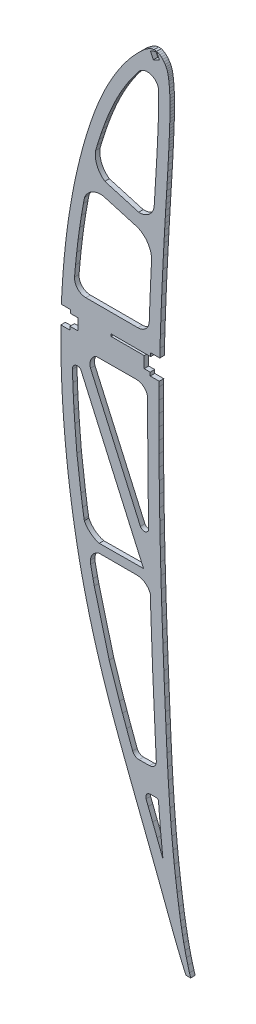
from build123d import *

# Parameters (mm, degrees)
EXTRUDE_1_DEPTH = 2


with BuildPart() as part:
    # Model → 凸台-拉伸1 (new body)
    with BuildSketch(Plane.XY):
        Polygon((43.850174871, 236.886299562), (43.850174871, 237.886299562), (61.338896891, 237.886299562), (61.338896891, 239.385577042), (65.379338159, 239.385577042), (65.486084254, 243.230870612), (65.650078365, 248.369915166), (65.831750008, 253.516738207), (66.029537281, 258.661262013), (66.243396564, 263.804485633), (66.47228519, 268.947364496), (66.717245826, 274.088943173), (66.976193138, 279.231132521), (67.249127124, 284.37393254), (67.390958025, 286.948569601), (67.535829689, 289.522338472), (67.683742117, 292.095239153), (67.833696262, 294.667228024), (67.986603931, 297.240346802), (68.141509697, 299.813552818), (68.297414511, 302.386802454), (68.455317422, 304.960139329), (68.612264904, 307.532433536), (68.76717067, 310.105639553), (68.91912291, 312.677715663), (69.065037242, 315.250529105), (69.204913665, 317.824079879), (69.335711416, 320.399236175), (69.396680003, 321.685119463), (69.456649542, 322.970959132), (69.513621937, 324.256667943), (69.568596235, 325.542289515), (69.621572436, 326.827823848), (69.672550541, 328.113270943), (69.721486931, 329.399629847), (69.768512462, 330.683903416), (69.812584469, 331.967047078), (69.851617614, 333.250971692), (69.882658375, 334.53454735), (69.90561951, 335.81977215), (69.916592067, 337.104473517), (69.914446139, 338.391604977), (69.897401726, 339.67608405), (69.864328922, 340.96086426), (69.814272299, 342.244902942), (69.745277379, 343.527113806), (69.656388733, 344.806454186), (69.546650932, 346.081881415), (69.414065881, 347.353308253), (69.328973034, 348.064273236), (69.226939987, 348.773497641), (69.101104261, 349.477678989), (68.942430801, 350.177423752), (68.741928174, 350.872339356), (68.492690281, 351.560122368), (68.183727592, 352.240292977), (67.760468238, 352.993547595), (67.2625898, 353.713515692), (66.70091153, 354.381651548), (66.085428108, 354.975369626), (65.428088689, 355.473170679), (64.738713477, 355.856465367), (64.026341723, 356.101625485), (62.864772411, 356.181034123), (61.688018623, 355.920456832), (60.511402447, 355.381620702), (59.348160633, 354.628163683), (58.214570693, 353.722855531), (57.12382576, 352.730333244), (56.09024887, 351.712280293), (55.348565983, 350.955207975), (54.644192637, 350.214778916), (53.970397212, 349.484693493), (53.323314373, 348.761780083), (52.696299736, 348.037740964), (52.085487969, 347.309404514), (51.485146496, 346.570514727), (50.521108765, 345.33528833), (49.572715245, 344.062708772), (48.641745937, 342.757858533), (47.730024458, 341.424821044), (46.840329858, 340.068722405), (45.973399468, 338.695600525), (45.131056906, 337.309538835), (44.374615701, 336.019315326), (43.641501559, 334.722102677), (42.929716386, 333.41781365), (42.238304751, 332.105405576), (41.567310275, 330.783879408), (40.91569029, 329.454190575), (40.282532985, 328.114297359), (39.696060836, 326.828492002), (39.125966032, 325.53439312), (38.570206859, 324.232912524), (38.028739696, 322.925049263), (37.501564545, 321.610803335), (36.987682356, 320.290131121), (36.486006842, 318.964987099), (35.553052213, 316.398849795), (34.661712852, 313.819515164), (33.811945139, 311.227982251), (33.000751931, 308.624120201), (32.225092462, 306.008797202), (31.483924065, 303.382968684), (30.775161405, 300.748545504), (30.112778564, 298.175203519), (29.479717077, 295.59513411), (28.873935227, 293.009249087), (28.296432064, 290.41759207), (27.745253109, 287.819076771), (27.221353792, 285.214745857), (26.723735064, 282.604555711), (25.825344876, 277.48149246), (25.023692086, 272.343634754), (24.315735929, 267.191850784), (23.697392974, 262.027964167), (23.164623409, 256.852799475), (22.714299231, 251.669222994), (22.342337007, 246.479058343), (22.048985863, 241.345376418), (21.91414288, 238.214788101), (25.849593636, 238.214788101), (25.849593636, 236.716177613), (28.169139089, 236.716177613), (29.169139089, 236.716177613), (29.259093636, 236.716177613), (29.259093636, 231.716177613), (25.676350645, 231.716177613), (25.676350645, 230.216198606), (21.668414736, 230.216198606), (21.645766461, 225.9354112), (21.686699817, 220.797105792), (21.793752909, 215.65837544), (21.966817578, 210.521217216), (22.202465585, 205.393457177), (22.50196586, 200.270156719), (22.864265788, 195.152260299), (23.28842091, 190.038715302), (23.773378612, 184.930466187), (24.319138893, 179.827512952), (24.924757295, 174.728802983), (25.594743635, 169.606539489), (26.326314776, 164.493620101), (27.122358171, 159.392204129), (27.98492497, 154.301401195), (28.914905554, 149.22326245), (29.916348147, 144.157005673), (30.991141666, 139.104736094), (32.158752702, 133.984386354), (33.403438416, 128.88323281), (34.721150583, 123.802057686), (36.113940354, 118.739970601), (37.578703963, 113.698806393), (39.114442871, 108.678510983), (40.721157081, 103.679084371), (42.431701671, 98.593146188), (44.205125111, 93.529641245), (46.030551655, 88.485977603), (47.898212251, 83.457620327), (49.799282306, 78.441087097), (51.723992767, 73.431842979), (53.662466427, 68.42735011), (55.616271571, 63.398650928), (57.569914478, 58.372947357), (59.522558849, 53.347189706), (61.470264615, 48.320163125), (63.410144324, 43.289708303), (65.339310524, 38.253665931), (67.256818756, 33.210983393), (68.210769465, 30.685876852), (69.164612016, 28.162767384), (70.122394635, 25.640872768), (71.088003311, 23.122406392), (72.06632257, 20.609635724), (73.062345094, 18.102831159), (74.078958337, 15.604152005), (75.136245033, 13.075628751), (76.215066904, 10.556283525), (76.939164139, 8.937793403), (79.043523482, 8.937793403), (78.499935121, 10.676021702), (77.797507495, 13.216753178), (77.140471769, 15.769957645), (76.546509931, 18.286519454), (75.999046687, 20.81361126), (75.493143431, 23.349964133), (75.024806017, 25.895361757), (74.586208387, 28.446375893), (74.175299391, 31.003896918), (73.78425297, 33.564496593), (73.05786571, 38.65566449), (72.39133657, 43.751075651), (71.781615864, 48.851566379), (71.227705053, 53.957082593), (70.723612918, 59.067299821), (70.268286844, 64.183162521), (69.85873122, 69.304508457), (69.490494151, 74.421081867), (69.160255555, 79.538711735), (68.861025674, 84.65701951), (68.586705131, 89.777677792), (68.333353858, 94.899471729), (68.092929483, 100.022967227), (67.860385244, 105.148892429), (67.632833688, 110.275088025), (67.409384436, 115.399502863), (67.190981947, 120.523189559), (66.978624756, 125.64620219), (66.773257322, 130.769593374), (66.576822639, 135.894469803), (66.390265166, 141.021884094), (66.214637517, 146.150891788), (66.049103392, 151.278443197), (65.895605786, 156.405645015), (65.754144699, 161.532497243), (65.624611973, 166.660996952), (65.506063151, 171.790091529), (65.400441227, 176.920887667), (65.306639506, 182.055328361), (65.225926919, 187.188475006), (65.159302004, 192.320381681), (65.106656601, 197.453045459), (65.069043328, 202.585521883), (65.047406642, 207.718863568), (65.040693926, 212.854014972), (65.05068594, 217.995078398), (65.077761235, 223.135064092), (65.120921275, 228.273917973), (65.146101689, 230.386406112), (61.163980104, 230.386406112), (61.163980104, 231.886299562), (58.504074871, 231.886299562), (58.504074871, 236.886299562), align=None)
        Polygon((64.008095768, 356.074274652), (61.282160574, 354.821178359), (62.5342142, 352.096198594), (65.260193013, 353.348295839), align=None, mode=Mode.SUBTRACT)
        with BuildLine():
            Line((30.374274121, 274.202817512), (30.758319621, 276.664196246))
            Line((30.758319621, 276.664196246), (31.642198975, 281.704511574))
            Line((31.642198975, 281.704511574), (32.128151273, 284.253507082))
            ThreePointArc((32.128151273, 284.253507082), (35.397512022, 287.984979182), (40.263467028, 288.951977432))
            Line((40.263467028, 288.951977432), (55.592885304, 284.522587206))
            ThreePointArc((55.592885304, 284.522587206), (60.324998263, 280.431061259), (61.723232999, 274.333650559))
            Line((61.723232999, 274.333650559), (61.477577761, 269.177492609))
            Line((61.477577761, 269.177492609), (61.248016622, 264.019503112))
            Line((61.248016622, 264.019503112), (61.033529041, 258.861169207))
            Line((61.033529041, 258.861169207), (60.729975381, 250.965620584))
            ThreePointArc((60.729975381, 250.965620584), (59.200621647, 247.554901981), (55.733666561, 246.157709557))
            Line((55.733666561, 246.157709557), (32.707526961, 246.157709557))
            ThreePointArc((32.707526961, 246.157709557), (29.022168778, 247.778636451), (27.726289071, 251.590455533))
            Line((27.726289071, 251.590455533), (28.142414759, 256.380381183))
            Line((28.142414759, 256.380381183), (28.666858866, 261.474674857))
            Line((28.666858866, 261.474674857), (29.27510201, 266.554216243))
            Line((29.27510201, 266.554216243), (29.97093989, 271.617815733))
            Line((29.97093989, 271.617815733), (30.374274121, 274.202817512))
        make_face(mode=Mode.SUBTRACT)
        with BuildLine():
            Line((37.028102844, 304.618767439), (37.784639216, 307.169612305))
            Line((37.784639216, 307.169612305), (38.574613525, 309.705363467))
            Line((38.574613525, 309.705363467), (39.400453673, 312.22392459))
            Line((39.400453673, 312.22392459), (40.265783225, 314.727992715))
            Line((40.265783225, 314.727992715), (41.173807483, 317.225557814))
            Line((41.173807483, 317.225557814), (41.65567902, 318.498390889))
            Line((41.65567902, 318.498390889), (42.151822083, 319.773473723))
            Line((42.151822083, 319.773473723), (42.659038474, 321.037962526))
            Line((42.659038474, 321.037962526), (43.179365069, 322.294762725))
            Line((43.179365069, 322.294762725), (43.713102697, 323.544673117))
            Line((43.713102697, 323.544673117), (44.258660953, 324.783074736))
            Line((44.258660953, 324.783074736), (44.817652962, 326.00863152))
            Line((44.817652962, 326.00863152), (45.421186874, 327.285835443))
            Line((45.421186874, 327.285835443), (46.041584161, 328.55181157))
            Line((46.041584161, 328.55181157), (46.679508163, 329.808205313))
            Line((46.679508163, 329.808205313), (47.336271292, 331.054845072))
            Line((47.336271292, 331.054845072), (48.012704116, 332.294353764))
            Line((48.012704116, 332.294353764), (48.708032371, 333.524705979))
            Line((48.708032371, 333.524705979), (49.424412669, 334.746599624))
            Line((49.424412669, 334.746599624), (50.224061361, 336.06240921))
            Line((50.224061361, 336.06240921), (51.044877686, 337.36249151))
            Line((51.044877686, 337.36249151), (51.884227414, 338.641853016))
            Line((51.884227414, 338.641853016), (52.740794994, 339.894249415))
            Line((52.740794994, 339.894249415), (53.612828588, 341.116495124))
            Line((53.612828588, 341.116495124), (54.496980837, 342.302874043))
            Line((54.496980837, 342.302874043), (55.396637073, 343.455608106))
            Line((55.396637073, 343.455608106), (55.546141861, 343.639615984))
            ThreePointArc((55.546141861, 343.639615984), (61.464890176, 345.950534188), (64.872282432, 340.587549704))
            Line((64.872282432, 340.587549704), (64.898255433, 339.578575725))
            Line((64.898255433, 339.578575725), (64.914501444, 338.354264818))
            Line((64.914501444, 338.354264818), (64.916556468, 337.121657497))
            Line((64.916556468, 337.121657497), (64.906000928, 335.885781685))
            Line((64.906000928, 335.885781685), (64.883738117, 334.639644855))
            Line((64.883738117, 334.639644855), (64.853454581, 333.387381414))
            Line((64.853454581, 333.387381414), (64.815192903, 332.12883283))
            Line((64.815192903, 332.12883283), (64.771653649, 330.861200092))
            Line((64.771653649, 330.861200092), (64.724965753, 329.586147407))
            Line((64.724965753, 329.586147407), (64.676317995, 328.307375554))
            Line((64.676317995, 328.307375554), (64.625653134, 327.029827127))
            Line((64.625653134, 327.029827127), (64.572995802, 325.75203055))
            Line((64.572995802, 325.75203055), (64.518352267, 324.474144175))
            Line((64.518352267, 324.474144175), (64.461808152, 323.198100431))
            Line((64.461808152, 323.198100431), (64.402109005, 321.918058396))
            Line((64.402109005, 321.918058396), (64.341721167, 320.64445523))
            Line((64.341721167, 320.64445523), (64.211800966, 318.086576198))
            Line((64.211800966, 318.086576198), (64.072725682, 315.527765382))
            Line((64.072725682, 315.527765382), (63.927478223, 312.966710472))
            Line((63.927478223, 312.966710472), (63.776038138, 310.403303568))
            Line((63.776038138, 310.403303568), (63.621300308, 307.832887207))
            Line((63.621300308, 307.832887207), (63.464598467, 305.26464601))
            Line((63.464598467, 305.26464601), (63.30680099, 302.69303224))
            Line((63.30680099, 302.69303224), (63.150661393, 300.115932062))
            Line((63.150661393, 300.115932062), (62.995639336, 297.540800473))
            Line((62.995639336, 297.540800473), (62.903634054, 296.012465006))
            ThreePointArc((62.903634054, 296.012465006), (60.544141572, 291.977384464), (56.089859449, 290.560186342))
            Line((56.089859449, 290.560186342), (41.102686095, 294.875237289))
            ThreePointArc((41.102686095, 294.875237289), (37.667869738, 299.162580622), (37.028102844, 304.618767439))
        make_face(mode=Mode.SUBTRACT)
        with BuildLine():
            Line((60.066594585, 221.028351207), (60.050711535, 218.013106135))
            Line((60.050711535, 218.013106135), (60.040687575, 212.855605871))
            Line((60.040687575, 212.855605871), (60.113866489, 196.724475795))
            Line((60.113866489, 196.724475795), (60.159634871, 192.262287098))
            Line((60.159634871, 192.262287098), (60.226437175, 187.116716737))
            Line((60.226437175, 187.116716737), (60.3073575, 181.97035839))
            Line((60.3073575, 181.97035839), (60.401381175, 176.823768569))
            Line((60.401381175, 176.823768569), (60.507252229, 171.680870469))
            ThreePointArc((60.507252229, 171.680870469), (59.057184214, 169.707142027), (56.807151625, 170.674434413))
            Line((56.807151625, 170.674434413), (34.75557672, 220.203082572))
            ThreePointArc((34.75557672, 220.203082572), (34.936176082, 223.561892523), (37.292812298, 225.961993804))
            Line((37.292812298, 225.961993804), (55.046849762, 226.05464949))
            ThreePointArc((55.046849762, 226.05464949), (58.604503484, 224.587915526), (60.066594585, 221.028351207))
        make_face(mode=Mode.SUBTRACT)
        with BuildLine():
            Line((31.909861435, 161.141744721), (31.271416711, 165.233195185))
            Line((31.271416711, 165.233195185), (30.548604273, 170.284900367))
            Line((30.548604273, 170.284900367), (28.751389661, 184.664252492))
            Line((28.751389661, 184.664252492), (27.849650881, 195.535468195))
            Line((27.849650881, 195.535468195), (27.491652448, 200.592601143))
            Line((27.491652448, 200.592601143), (27.305296676, 203.780433316))
            Line((27.305296676, 203.780433316), (27.19576315, 205.654131638))
            Line((27.19576315, 205.654131638), (26.962951761, 210.720166161))
            Line((26.962951761, 210.720166161), (26.791999342, 215.794625487))
            ThreePointArc((26.791999342, 215.794625487), (27.933018653, 217.949328047), (30.364761636, 217.772426229))
            Line((30.364761636, 217.772426229), (58.200167956, 155.253080019))
            Line((58.200167956, 155.253080019), (38.632644302, 155.101417879))
            ThreePointArc((38.632644302, 155.101417879), (34.759910816, 157.083057348), (32.037200272, 160.475962731))
            Line((32.037200272, 160.475962731), (31.909861435, 161.141744721))
        make_face(mode=Mode.SUBTRACT)
        with BuildLine():
            Line((64.834780159, 69.45761191), (64.872486697, 68.933687829))
            Line((64.872486697, 68.933687829), (64.873691866, 68.917823804))
            Line((64.873691866, 68.917823804), (65.285986013, 63.762233627))
            Line((65.285986013, 63.762233627), (65.745417915, 58.600239479))
            Line((65.745417915, 58.600239479), (66.254246921, 53.442002372))
            Line((66.254246921, 53.442002372), (66.802401919, 48.389538733))
            Line((66.802401919, 48.389538733), (66.133985339, 50.1228624))
            Line((66.133985339, 50.1228624), (64.184849609, 55.153579716))
            Line((64.184849609, 55.153579716), (62.230506775, 60.183714995))
            Line((62.230506775, 60.183714995), (60.276544652, 65.210239957))
            Line((60.276544652, 65.210239957), (59.334904202, 67.63383208))
            ThreePointArc((59.334904202, 67.63383208), (59.542698446, 69.478950415), (61.178195322, 70.358035216))
            Line((61.178195322, 70.358035216), (63.82688816, 70.385773276))
            ThreePointArc((63.82688816, 70.385773276), (64.514772434, 70.121431477), (64.834780159, 69.45761191))
        make_face(mode=Mode.SUBTRACT)
        with BuildLine():
            Line((43.040406181, 112.591472421), (47.550785889, 99.103405346))
            Line((47.550785889, 99.103405346), (48.915496936, 95.206862099))
            Line((48.915496936, 95.206862099), (50.724972576, 90.207270891))
            Line((50.724972576, 90.207270891), (53.388640228, 83.035800524))
            ThreePointArc((53.388640228, 83.035800524), (54.501188445, 81.608325897), (56.232334128, 81.08051725))
            Line((56.232334128, 81.08051725), (60.887747706, 81.129270409))
            ThreePointArc((60.887747706, 81.129270409), (63.040222345, 82.07225772), (63.852668845, 84.277320717))
            Line((63.852668845, 84.277320717), (63.339146773, 94.65877334))
            Line((63.339146773, 94.65877334), (63.21869495, 97.225627774))
            Line((63.21869495, 97.225627774), (62.292216883, 117.134425409))
            Line((62.292216883, 117.134425409), (61.580305489, 135.707815185))
            Line((61.580305489, 135.707815185), (61.393376937, 140.845428305))
            Line((61.393376937, 140.845428305), (61.217398837, 146.983885542))
            ThreePointArc((61.217398837, 146.983885542), (58.955950897, 150.083436604), (55.309116372, 151.275896881))
            Line((55.309116372, 151.275896881), (38.632644302, 151.275896881))
            ThreePointArc((38.632644302, 151.275896881), (35.926806977, 149.609031288), (34.735578851, 146.662682346))
            Line((34.735578851, 146.662682346), (34.81442926, 145.162046809))
            Line((34.81442926, 145.162046809), (35.874112632, 140.180805321))
            Line((35.874112632, 140.180805321), (36.449660122, 137.65684456))
            Line((36.449660122, 137.65684456), (43.040406181, 112.591472421))
        make_face(mode=Mode.SUBTRACT)
    extrude(amount=EXTRUDE_1_DEPTH)


solid = part.part
